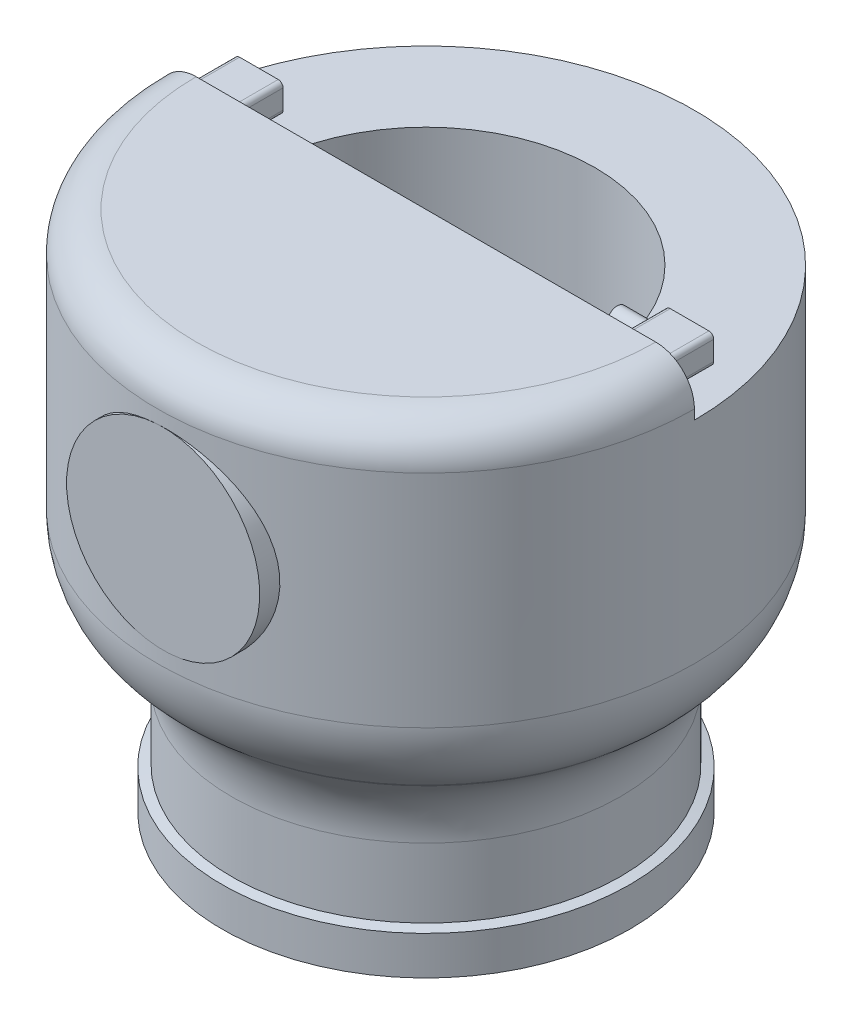
from build123d import *
from build123d.topology import SkipClean

# Parameters (mm, degrees)
SKETCH10_R              = 10
BOSS_EXTRUDE1_DEPTH     = 5
CUT_EXTRUDE3_DEPTH      = 45
CUT_EXTRUDE3_DEPTH_BACK = 20
CUT_EXTRUDE5_DEPTH      = 5
BOSS_EXTRUDE2_DEPTH     = 5
SKETCH14_R              = 1
BOSS_EXTRUDE3_DEPTH     = 3


with BuildPart() as part:
    # Sketch1 → Revolve1 (revolve)
    with BuildSketch(Plane.XY):
        with BuildLine():
            Line((20.9, 0), (23.871591838, 0))
            Line((23.871591838, 0), (23.871591838, 4))
            Line((23.871591838, 4), (22.9, 4.236662843))
            Line((22.9, 4.236662843), (22.9, 11.404308102))
            ThreePointArc((22.9, 11.404308102), (23.83692213, 15.63049072), (26.472123903, 19.064752533))
            Line((26.472123903, 19.064752533), (26.988320528, 19.497892931))
            ThreePointArc((26.988320528, 19.497892931), (29.623522302, 22.932154745), (30.560444431, 27.158337362))
            Line((30.560444431, 27.158337362), (30.560444431, 50))
            ThreePointArc((30.560444431, 50), (29.388871556, 52.828427125), (26.560444431, 54))
            Line((26.560444431, 54), (2.764914955, 54))
            Line((2.764914955, 54), (2.764914955, 15))
            Line((2.764914955, 15), (19.9, 15))
            ThreePointArc((19.9, 15), (20.607106781, 14.707106781), (20.9, 14))
            Line((20.9, 14), (20.9, 0))
        make_face()
    revolve(axis=Axis((2.764914955, 7.821821657, 0), (0, 1, 0)))

    # Sketch10 → Boss-Extrude1 (add)
    with SkipClean():  # the faces are left unmerged after this step: merging them gives an invalid solid
        with BuildSketch(Plane.XY.offset(27.795529476)):
            with Locations((3.346345887, 38.658337362)):
                Circle(SKETCH10_R)
        extrude(amount=-BOSS_EXTRUDE1_DEPTH)

    # Sketch11 → Cut-Extrude3 (cut, two sides: drawn at the far end of the back side and taken through both)
    with SkipClean():  # the faces are left unmerged after this step: merging them gives an invalid solid
        with BuildSketch(Plane(origin=(0, 17, 0), x_dir=(1, 0, 0), z_dir=(0, 1, 0)).offset(-CUT_EXTRUDE3_DEPTH_BACK)):
            with BuildLine():
                Line((-14.735085045, 0), (20.264914955, 0))
                ThreePointArc((20.264914955, 0), (2.764914955, 17.5), (-14.735085045, 0))
            make_face()
        extrude(amount=CUT_EXTRUDE3_DEPTH + CUT_EXTRUDE3_DEPTH_BACK, mode=Mode.SUBTRACT)

    # Sketch9 → Cut-Extrude5 (cut)
    with SkipClean():  # the faces are left unmerged after this step: merging them gives an invalid solid
        with BuildSketch(Plane(origin=(0, 54, 0), x_dir=(1, 0, 0), z_dir=(0, 1, 0))):
            with BuildLine():
                Line((-25.235085045, 0), (30.764914955, 0))
                ThreePointArc((30.764914955, 0), (2.764914955, 28), (-25.235085045, 0))
            make_face()
        extrude(amount=-CUT_EXTRUDE5_DEPTH, mode=Mode.SUBTRACT)

    # Sketch13 → Boss-Extrude2 (add)
    with SkipClean():  # the faces are left unmerged after this step: merging them gives an invalid solid
        with BuildSketch(Plane(origin=(0, 0, 0), x_dir=(-1, 0, 0), z_dir=(0, 0, -1))):
            with BuildLine():
                Line((17.53061452, 53), (21.53061452, 53))
                ThreePointArc((21.53061452, 53), (21.884167911, 52.853553391), (22.03061452, 52.5))
                Line((22.03061452, 52.5), (22.03061452, 50.5))
                ThreePointArc((22.03061452, 50.5), (21.884167911, 50.146446609), (21.53061452, 50))
                Line((21.53061452, 50), (17.53061452, 50))
                ThreePointArc((17.53061452, 50), (17.17706113, 50.146446609), (17.03061452, 50.5))
                Line((17.03061452, 50.5), (17.03061452, 52.5))
                ThreePointArc((17.03061452, 52.5), (17.17706113, 52.853553391), (17.53061452, 53))
            make_face()
            with BuildLine():
                Line((-27.060444431, 52.75), (-23.060444431, 52.75))
                ThreePointArc((-23.060444431, 52.75), (-22.706891041, 52.603553391), (-22.560444431, 52.25))
                Line((-22.560444431, 52.25), (-22.560444431, 50.25))
                ThreePointArc((-22.560444431, 50.25), (-22.706891041, 49.896446609), (-23.060444431, 49.75))
                Line((-23.060444431, 49.75), (-27.060444431, 49.75))
                ThreePointArc((-27.060444431, 49.75), (-27.413997822, 49.896446609), (-27.560444431, 50.25))
                Line((-27.560444431, 50.25), (-27.560444431, 52.25))
                ThreePointArc((-27.560444431, 52.25), (-27.413997822, 52.603553391), (-27.060444431, 52.75))
            make_face()
        extrude(amount=BOSS_EXTRUDE2_DEPTH)

    # Sketch14 → Boss-Extrude3 (add)
    with SkipClean():  # the faces are left unmerged after this step: merging them gives an invalid solid
        with BuildSketch(Plane.ZY.offset(-22.560444431)):
            with Locations((-3, 51.25)):
                Circle(SKETCH14_R)
        extrude(amount=BOSS_EXTRUDE3_DEPTH)


solid = part.part
